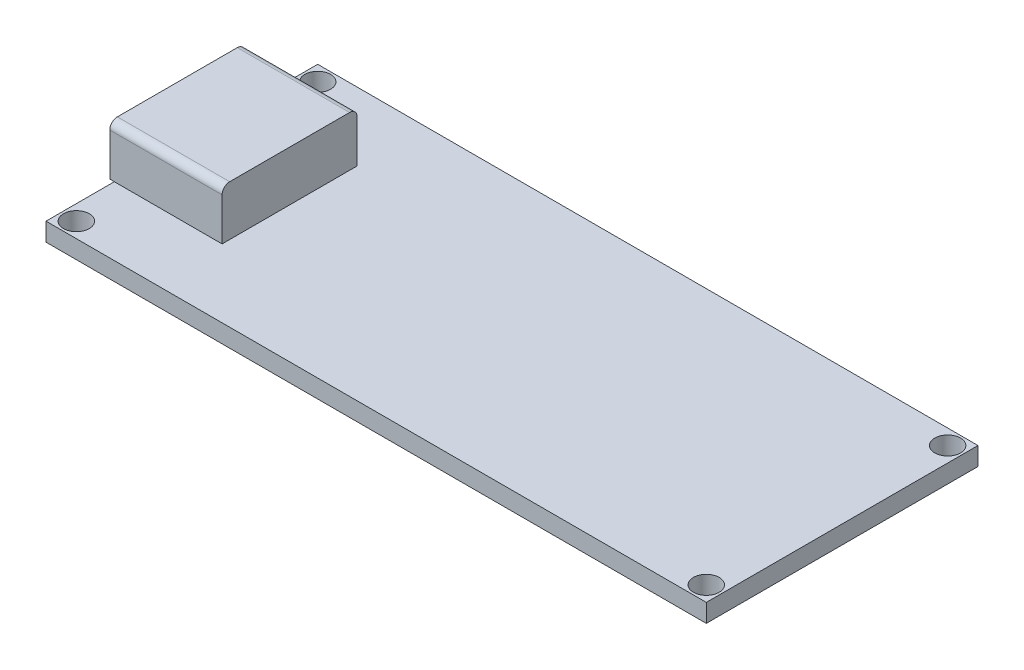
from build123d import *

# Parameters (mm, degrees)
SKETCH1_W           = 43.5
SKETCH1_H           = 17.9
SKETCH1_R           = 0.85
BOSS_EXTRUDE1_DEPTH = 1.2
SKETCH2_W           = 7.4
SKETCH2_H           = 8.9
BOSS_EXTRUDE2_DEPTH = 3.3
FILLET1_R           = 0.5


with BuildPart() as part:
    # Sketch1 → Boss-Extrude1 (new body)
    with BuildSketch(Plane(origin=(0, 0, 0), x_dir=(1, 0, 0), z_dir=(0, 1, 0))):
        Rectangle(SKETCH1_W, SKETCH1_H)
        with Locations(Location((-20.75, 7.95, 0), (0, 0, 270))):
            Circle(SKETCH1_R, mode=Mode.SUBTRACT)
        with Locations(Location((20.75, -7.95, 0), (0, 0, 270))):
            Circle(SKETCH1_R, mode=Mode.SUBTRACT)
        with Locations(Location((20.75, 7.95, 0), (0, 0, 270))):
            Circle(SKETCH1_R, mode=Mode.SUBTRACT)
        with Locations(Location((-20.75, -7.95, 0), (0, 0, 270))):
            Circle(SKETCH1_R, mode=Mode.SUBTRACT)
    extrude(amount=BOSS_EXTRUDE1_DEPTH)

    # Sketch2 → Boss-Extrude2 (add)
    with BuildSketch(Plane(origin=(0, 1.2, 0), x_dir=(1, 0, 0), z_dir=(0, 1, 0))):
        with Locations((-18.35, 0)):
            Rectangle(SKETCH2_W, SKETCH2_H)
    extrude(amount=BOSS_EXTRUDE2_DEPTH)

    # Fillet1
    fillet1_edges = [part.edges().sort_by_distance(p)[0] for p in [
        (-18.35, 4.5, 4.45),
        (-18.35, 4.5, -4.45),
    ]]
    fillet(fillet1_edges, radius=FILLET1_R)


solid = part.part
